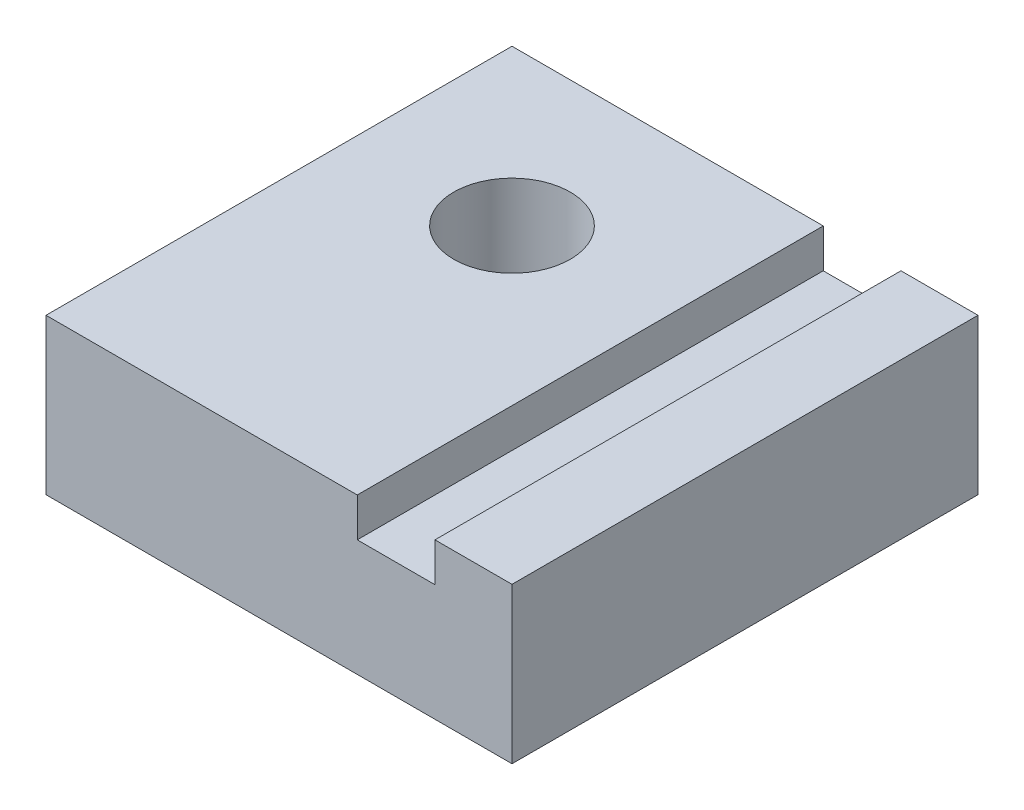
from build123d import *

# Parameters (mm, degrees)
SKETCH1_W           = 76.155927022
SKETCH1_H           = 76.155927022
SKETCH1_R           = 9.525
BOSS_EXTRUDE1_DEPTH = 25.4
SKETCH2_W           = 12.7
SKETCH2_H           = 6.35
CUT_EXTRUDE1_DEPTH  = 89.852780068


with BuildPart() as part:
    # Sketch1 → Boss-Extrude1 (new body)
    with BuildSketch(Plane(origin=(0, 0, 0), x_dir=(1, 0, 0), z_dir=(0, 1, 0))):
        Rectangle(SKETCH1_W, SKETCH1_H)
        with Locations(Location((-12.677963511, 12.677963511, 0), (0, 0, 270))):
            Circle(SKETCH1_R, mode=Mode.SUBTRACT)
    extrude(amount=BOSS_EXTRUDE1_DEPTH)

    # Sketch2 → Cut-Extrude1 (cut, through all)
    with BuildSketch(Plane.XY.offset(38.077963511)):
        with Locations((19.139376005, 22.225)):
            Rectangle(SKETCH2_W, SKETCH2_H)
    extrude(amount=-CUT_EXTRUDE1_DEPTH, mode=Mode.SUBTRACT)


solid = part.part
